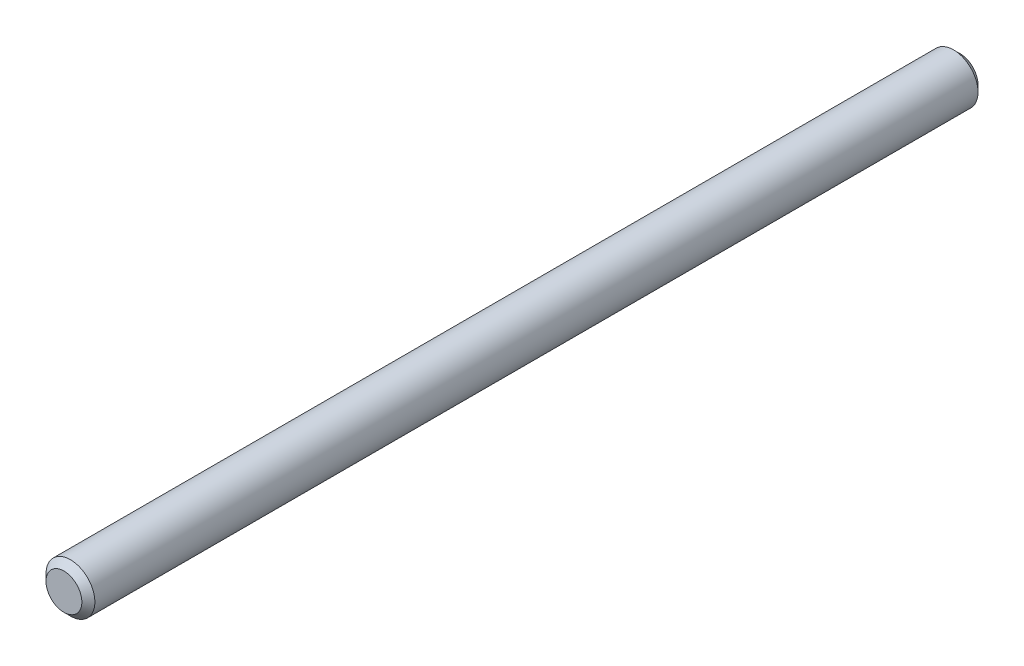
from build123d import *

# Parameters (mm, degrees)
IZIM1_R                     = 7.5
Y_KSEKLIK_EKSTR_ZYON1_DEPTH = 137.5
PAH1_SIZE                   = 2


with BuildPart() as part:
    # Çizim1 → Yükseklik-Ekstrüzyon1 (new, symmetric)
    with BuildSketch(Plane.XY):
        Circle(IZIM1_R)
    extrude(amount=Y_KSEKLIK_EKSTR_ZYON1_DEPTH, both=True)

    # Pah1
    pah1_edges = [part.edges().sort_by_distance(p)[0] for p in [
        (-7.5, 0, -137.5),
        (-7.5, 0, 137.5),
    ]]
    chamfer(pah1_edges, length=PAH1_SIZE)


solid = part.part
